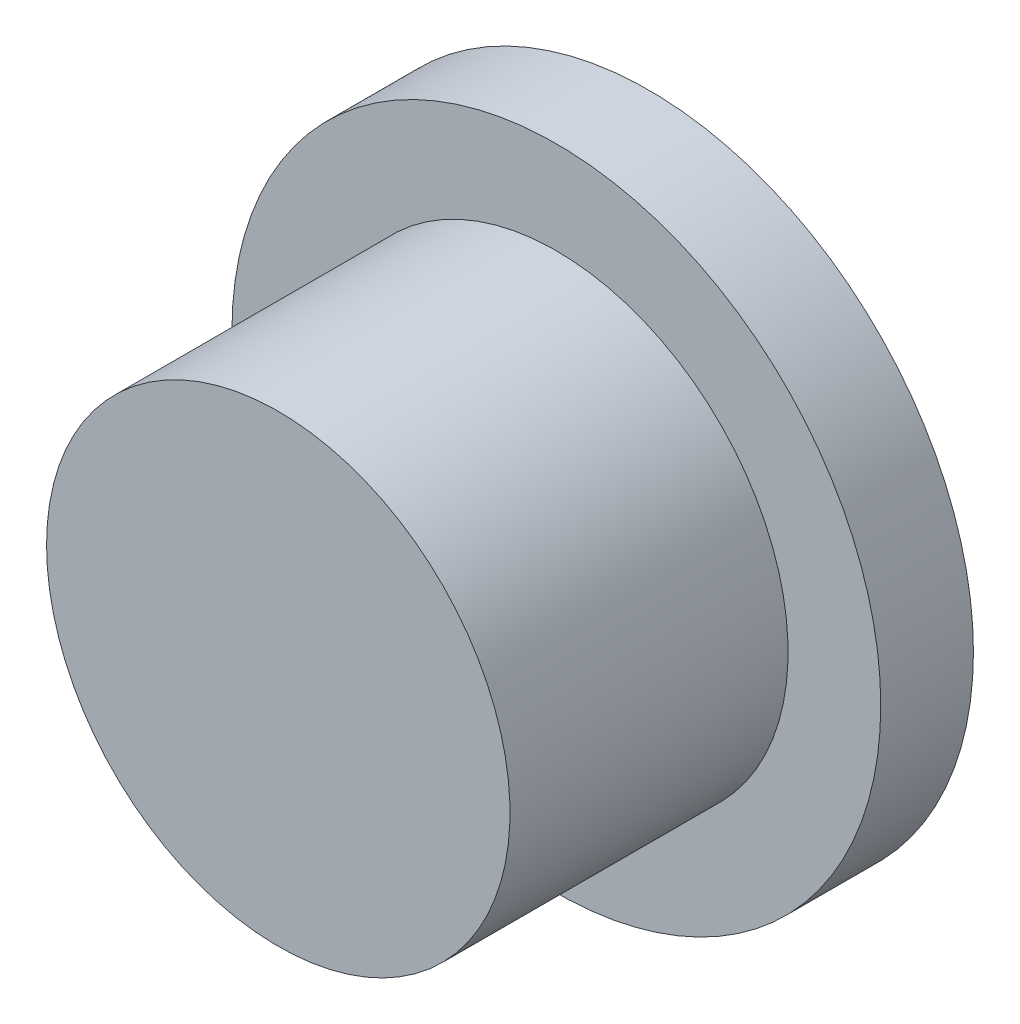
from build123d import *

# Parameters (mm, degrees)
SKETCH2_R           = 8.89
BOSS_EXTRUDE1_DEPTH = 2.54
SKETCH3_R           = 6.35
BOSS_EXTRUDE2_DEPTH = 7.62


with BuildPart() as part:
    # Sketch2 → Boss-Extrude1 (new body)
    with BuildSketch(Plane.XY):
        Circle(SKETCH2_R)
    extrude(amount=BOSS_EXTRUDE1_DEPTH)

    # Sketch3 → Boss-Extrude2 (add)
    with BuildSketch(Plane.XY.offset(2.54)):
        with Locations(Location((0, 0, 0), (0, 0, 180))):
            Circle(SKETCH3_R)
    extrude(amount=BOSS_EXTRUDE2_DEPTH)


solid = part.part
